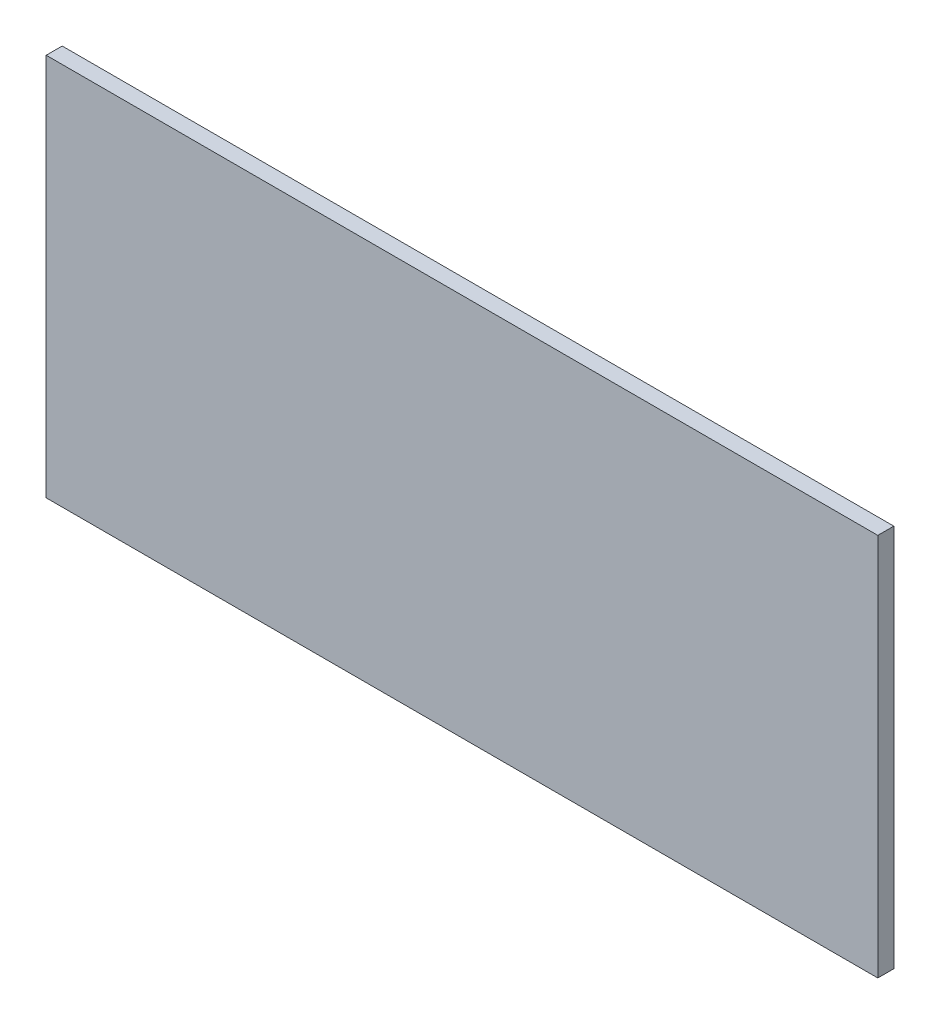
from build123d import *

# Parameters (mm, degrees)
SKETCH1_W           = 309.225
SKETCH1_H           = 88.644
BOSS_EXTRUDE1_DEPTH = 2.286
CUT_EXTRUDE4_DEPTH  = 161.856117808


with BuildPart() as part:
    # Sketch1 → Boss-Extrude1 (new body)
    with BuildSketch(Plane.XY):
        Rectangle(SKETCH1_W, SKETCH1_H)
    extrude(amount=BOSS_EXTRUDE1_DEPTH)

    # Sketch4 → Cut-Extrude4 (cut, through all)
    with BuildSketch(Plane.XY.offset(2.286)):
        Polygon((154.6125, 10.473715629), (154.6125, 44.322), (-154.6125, 44.322), (-154.6125, -44.322), (35.739944789, -44.322), (35.739944789, 10.473715629), align=None)
    extrude(amount=-CUT_EXTRUDE4_DEPTH, mode=Mode.SUBTRACT)


solid = part.part
